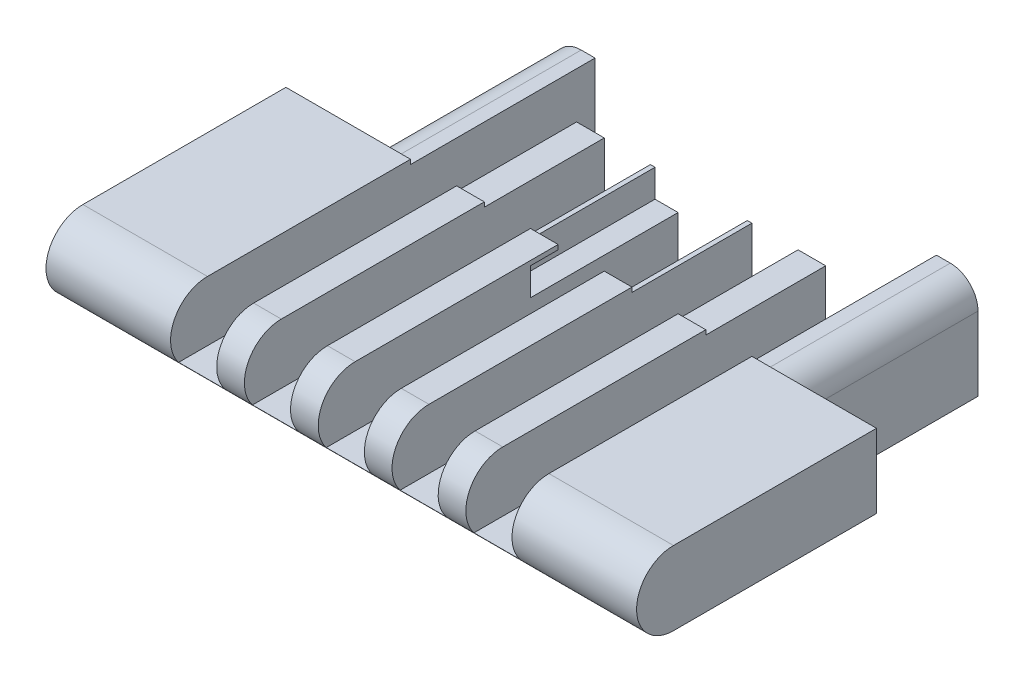
from build123d import *

# Parameters (mm, degrees)
BOSS_EXTRUDE1_DEPTH = 2
BOSS_EXTRUDE2_DEPTH = 3.2
SKETCH3_OUTSIDE_W   = 10.04
SKETCH3_OUTSIDE_H   = 5.89
CUT_EXTRUDE1_DEPTH  = 4.8
SKETCH4_W           = 1
SKETCH4_H           = 0.3
CUT_EXTRUDE3_DEPTH  = 2.3
CUT_EXTRUDE6_DEPTH  = 7.038418667
SKETCH6_W           = 0.5
SKETCH6_H           = 0.5
CUT_EXTRUDE7_DEPTH  = 2
SKETCH7_W           = 0.5
SKETCH7_H           = 0.8
CUT_EXTRUDE8_DEPTH  = 7
SKETCH8_W           = 6
SKETCH8_H           = 1
CUT_EXTRUDE9_DEPTH  = 0.5


with BuildPart() as part:
    # Sketch1 → Boss-Extrude1 (new body)
    with BuildSketch(Plane.XY):
        with BuildLine():
            Line((-2.7, 1.5), (2.7, 1.5))
            ThreePointArc((2.7, 1.5), (2.912132034, 1.412132034), (3, 1.2))
            Line((3, 1.2), (3, 0))
            Line((3, 0), (-3, 0))
            Line((-3, 0), (-3, 1.2))
            ThreePointArc((-3, 1.2), (-2.912132034, 1.412132034), (-2.7, 1.5))
        make_face()
    extrude(amount=BOSS_EXTRUDE1_DEPTH)

    # Sketch2 → Boss-Extrude2 (add, symmetric)
    with BuildSketch(Plane(origin=(0, 0, 0), x_dir=(0, 0, -1), z_dir=(1, 0, 0))):
        with BuildLine():
            Line((0, 2.25), (-4.2, 2.25))
            ThreePointArc((-4.2, 2.25), (-4.6, 1.85), (-4.2, 1.45))
            Line((-4.2, 1.45), (0, 1.45))
            Line((0, 1.45), (0, 2.25))
        make_face()
    extrude(amount=BOSS_EXTRUDE2_DEPTH, both=True)

    # Sketch3 outside → Cut-Extrude1 (cut)
    with BuildSketch(Plane.XY.offset(2)):
        with Locations((0, 1.125)):
            Rectangle(SKETCH3_OUTSIDE_W, SKETCH3_OUTSIDE_H)
        with BuildLine():
            Line((-2, 2.2), (2, 2.2))
            ThreePointArc((2, 2.2), (2.212132034, 2.112132034), (2.3, 1.9))
            Line((2.3, 1.9), (2.3, 1.1))
            Line((2.3, 1.1), (1.8, 0.6))
            Line((1.8, 0.6), (-1.8, 0.6))
            Line((-1.8, 0.6), (-2.3, 1.1))
            Line((-2.3, 1.1), (-2.3, 1.9))
            ThreePointArc((-2.3, 1.9), (-2.212132034, 2.112132034), (-2, 2.2))
        make_face(mode=Mode.SUBTRACT)
    extrude(amount=-CUT_EXTRUDE1_DEPTH, mode=Mode.SUBTRACT)

    # Sketch4 → Cut-Extrude3 (cut)
    with BuildSketch(Plane.XY):
        with Locations((0, 2.05)):
            Rectangle(SKETCH4_W, SKETCH4_H)
    extrude(amount=CUT_EXTRUDE3_DEPTH, mode=Mode.SUBTRACT)

    # Sketch5 → Cut-Extrude6 (cut, through all)
    with BuildSketch(Plane(origin=(0, 0, 0), x_dir=(1, 0, 0), z_dir=(0, 1, 0))):
        Polygon((-1.85, 0), (1.85, 0), (1.85, -1), (1.35, -1), (1.35, -0.7), (1.05, -0.7), (1.05, -1), (0.55, -1), (0.55, -0.7), (0.25, -0.7), (0.25, -1), (-0.25, -1), (-0.25, -0.7), (-0.55, -0.7), (-0.55, -1), (-1.05, -1), (-1.05, -0.7), (-1.35, -0.7), (-1.35, -1), (-1.85, -1), align=None)
    extrude(amount=CUT_EXTRUDE6_DEPTH, mode=Mode.SUBTRACT)

    # Sketch6 → Cut-Extrude7 (cut)
    with BuildSketch(Plane.XY.offset(2)):
        with Locations((1.6, 1.65)):
            Rectangle(SKETCH6_W, SKETCH6_H)
        with Locations((0.8, 1.65)):
            Rectangle(SKETCH6_W, SKETCH6_H)
        with Locations((0, 1.65)):
            Rectangle(SKETCH6_W, SKETCH6_H)
        with Locations((-0.8, 1.65)):
            Rectangle(SKETCH6_W, SKETCH6_H)
        with Locations((-1.6, 1.65)):
            Rectangle(SKETCH6_W, SKETCH6_H)
    extrude(amount=-CUT_EXTRUDE7_DEPTH, mode=Mode.SUBTRACT)

    # Sketch7 → Cut-Extrude8 (cut)
    with BuildSketch(Plane.XY):
        with Locations((1.6, 2)):
            Rectangle(SKETCH7_W, SKETCH7_H)
        with Locations((0.8, 2)):
            Rectangle(SKETCH7_W, SKETCH7_H)
        with Locations((0, 2)):
            Rectangle(SKETCH7_W, SKETCH7_H)
        with Locations((-0.8, 2)):
            Rectangle(SKETCH7_W, SKETCH7_H)
        with Locations((-1.6, 2)):
            Rectangle(SKETCH7_W, SKETCH7_H)
    extrude(amount=CUT_EXTRUDE8_DEPTH, mode=Mode.SUBTRACT)

    # Sketch8 → Cut-Extrude9 (cut)
    with BuildSketch(Plane(origin=(0, 0.6, 0), x_dir=(1, 0, 0), z_dir=(0, 1, 0))):
        with Locations((0, -0.5)):
            Rectangle(SKETCH8_W, SKETCH8_H)
    extrude(amount=CUT_EXTRUDE9_DEPTH, mode=Mode.SUBTRACT)


solid = part.part
